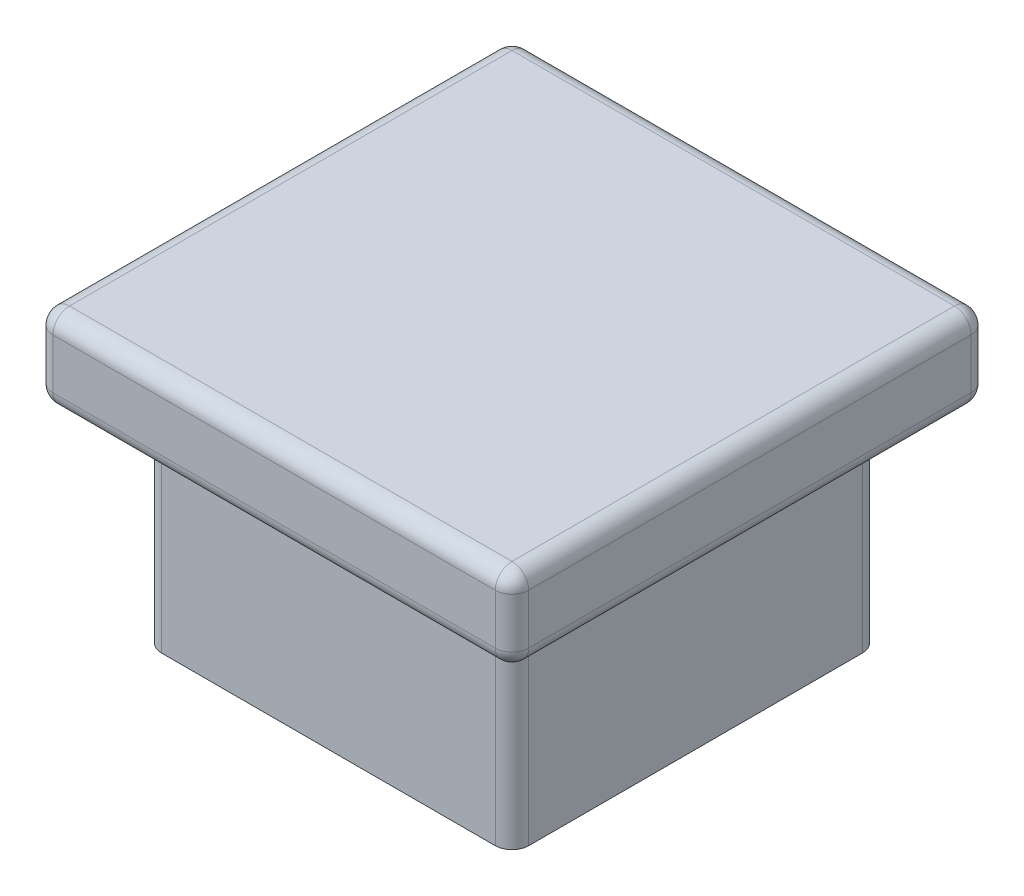
from build123d import *

# Parameters (mm, degrees)
SKETCH1_W           = 44
SKETCH1_H           = 44
SKETCH1_W_2         = 38
SKETCH1_H_2         = 38
BOSS_EXTRUDE1_DEPTH = 25
SKETCH2_W           = 57
SKETCH2_H           = 57
BOSS_EXTRUDE2_DEPTH = 10
SKETCH3_W           = 51.5
SKETCH3_H           = 51.5
SKETCH3_W_2         = 44
SKETCH3_H_2         = 44
CUT_EXTRUDE1_DEPTH  = 4
FILLET1_R           = 2


with BuildPart() as part:
    # Sketch1 → Boss-Extrude1 (new body)
    with BuildSketch(Plane(origin=(0, 0, 0), x_dir=(1, 0, 0), z_dir=(0, 1, 0))):
        Rectangle(SKETCH1_W, SKETCH1_H)
        Rectangle(SKETCH1_W_2, SKETCH1_H_2, mode=Mode.SUBTRACT)
    extrude(amount=BOSS_EXTRUDE1_DEPTH)

    # Sketch2 → Boss-Extrude2 (add)
    with BuildSketch(Plane(origin=(0, 25, 0), x_dir=(1, 0, 0), z_dir=(0, 1, 0))):
        Rectangle(SKETCH2_W, SKETCH2_H)
    extrude(amount=BOSS_EXTRUDE2_DEPTH)

    # Sketch3 → Cut-Extrude1 (cut)
    with BuildSketch(Plane.XZ.offset(-25)):
        Rectangle(SKETCH3_W, SKETCH3_H)
        Rectangle(SKETCH3_W_2, SKETCH3_H_2, mode=Mode.SUBTRACT)
    extrude(amount=-CUT_EXTRUDE1_DEPTH, mode=Mode.SUBTRACT)

    # Fillet1
    fillet1_edges = [part.edges().sort_by_distance(p)[0] for p in [
        (28.5, 25, 0),
        (28.5, 30, 28.5),
        (0, 25, -28.5),
        (28.5, 30, -28.5),
        (-28.5, 25, 0),
        (-28.5, 30, -28.5),
        (0, 25, 28.5),
        (-28.5, 30, 28.5),
        (28.5, 35, 0),
        (0, 35, -28.5),
        (-28.5, 35, 0),
        (0, 35, 28.5),
        (22, 14.5, 22),
        (-22, 14.5, 22),
        (-22, 14.5, -22),
        (22, 14.5, -22),
    ]]
    fillet(fillet1_edges, radius=FILLET1_R)


solid = part.part
